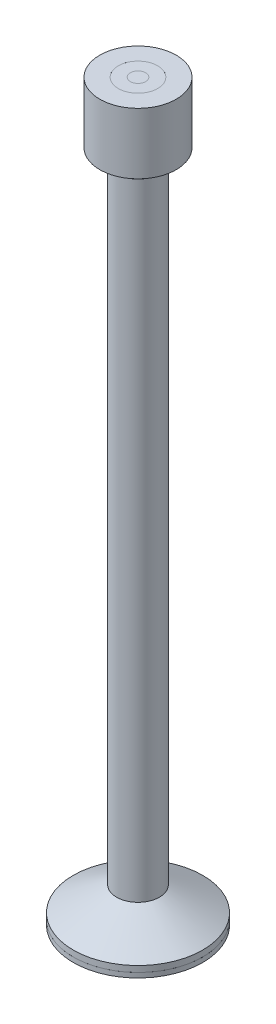
from build123d import *

# Parameters (mm, degrees)
CROQUIS4_R              = 1.375
SALIENTE_EXTRUIR1_DEPTH = 0.1
CROQUIS5_R              = 5.375
SALIENTE_EXTRUIR2_DEPTH = 0.4


with BuildPart() as part:
    # Croquis1 → Revolución1 (revolve)
    with BuildSketch(Plane.XY, mode=Mode.PRIVATE) as revoluci_n1_sk:
        Polygon((5.375, 0), (5.375, 0.5), (1.78, 2.5), (1.78, 54.5), (3.171785891, 55.5), (3.171785891, 60.571), (1.635, 60.571), (1.375, 54.942193309), (1.375, 0), align=None)
        Polygon((0.375, 0.1), (0.375, 54.942193309), (0.635, 60.571), (0.442390715, 60.571), (0, 60.571), (0, 0.1), align=None)
    revolve(revoluci_n1_sk.sketch.rotate(Axis((0, 60.571, 0), (0, -1, 0)), 180), axis=Axis((0, 60.571, 0), (0, -1, 0)))


with BuildPart() as body_2:
    # Croquis3 → Revolución2 (revolve)
    with BuildSketch(Plane.XY, mode=Mode.PRIVATE) as revoluci_n2_sk:
        Polygon((0.375, 54.942193309), (0.635, 60.571), (1.635, 60.571), (1.375, 54.942193309), (1.375, 0.1), (0.375, 0.1), align=None)
    revolve(revoluci_n2_sk.sketch.rotate(Axis((0, 55.5, 0), (0, -1, 0)), 90), axis=Axis((0, 55.5, 0), (0, -1, 0)))


with BuildPart() as body_3:
    # Croquis4 → Saliente-Extruir1 (new body)
    with BuildSketch(Plane.XZ):
        Circle(CROQUIS4_R)
    extrude(amount=-SALIENTE_EXTRUIR1_DEPTH)

    # Croquis5 → Saliente-Extruir2 (add)
    with BuildSketch(Plane.XZ):
        Circle(CROQUIS5_R)
    extrude(amount=SALIENTE_EXTRUIR2_DEPTH)


solid = Compound([part.part, body_2.part, body_3.part])
